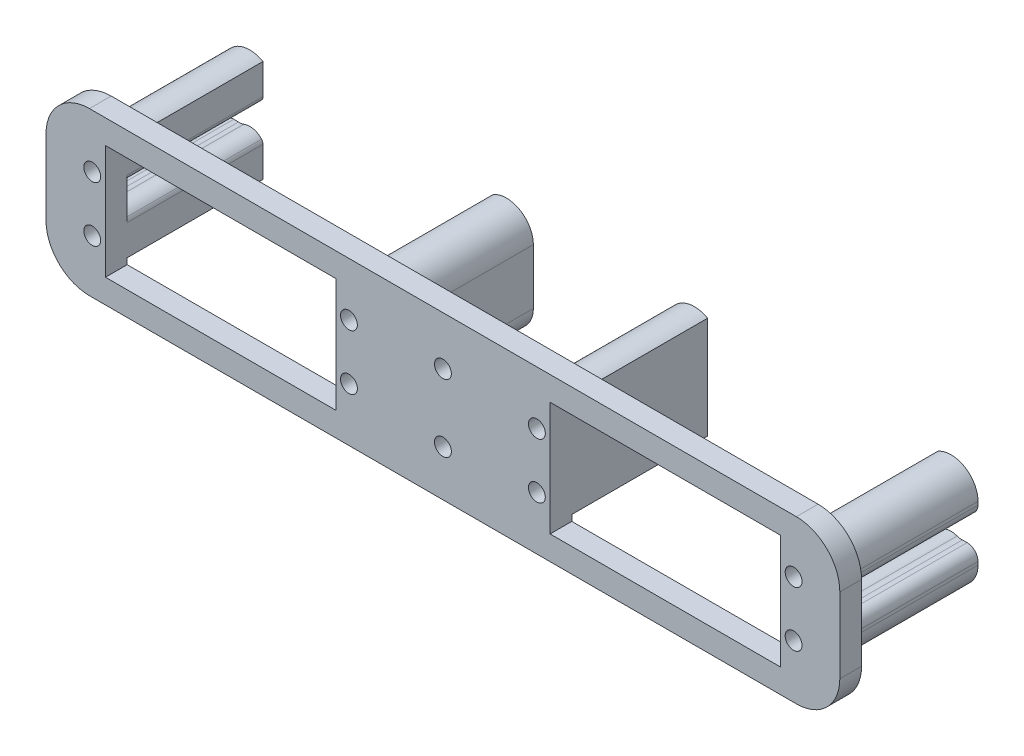
from build123d import *

# Parameters (mm, degrees)
SKETCH1_W                      = 146.142719433
SKETCH1_H                      = 29.841975708
BOSS_EXTRUDE1_DEPTH            = 4
SKETCH2_W                      = 42.4
SKETCH2_H                      = 21
CUT_EXTRUDE1_DEPTH             = 120.920808812
SKETCH3_W                      = 42.4
SKETCH3_H                      = 21
CUT_EXTRUDE2_DEPTH             = 120.920808812
BOSS_EXTRUDE2_DEPTH            = 25
BOSS_EXTRUDE3_DEPTH            = 25
BOSS_EXTRUDE4_DEPTH            = 25
BOSS_EXTRUDE5_DEPTH            = 25
BOSS_EXTRUDE6_DEPTH            = 25
BOSS_EXTRUDE7_DEPTH            = 25
F_3_1_3_1_DIAMETER_HOLE1_D     = 3.1
F_3_1_3_1_DIAMETER_HOLE1_DEPTH = 29
F_3_1_3_1_DIAMETER_HOLE2_D     = 3.1
FILLET1_R                      = 1
FILLET2_R                      = 2
FILLET3_R                      = 8


with BuildPart() as part:
    # Sketch1 → Boss-Extrude1 (new body)
    with BuildSketch(Plane.XY.offset(29.720987506)):
        with Locations((40.928641953, 22.079012221)):
            Rectangle(SKETCH1_W, SKETCH1_H)
    extrude(amount=-BOSS_EXTRUDE1_DEPTH)

    # Sketch2 → Cut-Extrude1 (cut, through all)
    with BuildSketch(Plane.XY.offset(29.720987506)):
        with Locations((0, 22.079011948)):
            Rectangle(SKETCH2_W, SKETCH2_H)
    extrude(amount=-CUT_EXTRUDE1_DEPTH, mode=Mode.SUBTRACT)

    # Sketch3 → Cut-Extrude2 (cut, through all)
    with BuildSketch(Plane(origin=(0, 0, 25.720987506), x_dir=(-1, 0, 0), z_dir=(0, 0, -1))):
        with Locations((-81.857283905, 22.079012494)):
            Rectangle(SKETCH3_W, SKETCH3_H)
    extrude(amount=-CUT_EXTRUDE2_DEPTH, mode=Mode.SUBTRACT)

    # Sketch4 → Boss-Extrude2 (add)
    with BuildSketch(Plane(origin=(0, 0, 25.720987506), x_dir=(-1, 0, 0), z_dir=(0, 0, -1))):
        with BuildLine():
            Line((28.579999925, 27.164011892), (28.579999925, 24.579012633))
            Line((28.579999925, 24.579012633), (25.700002555, 24.579012633))
            ThreePointArc((25.700002555, 24.579012633), (25.204684679, 24.573625897), (24.72588263, 24.446671519))
            ThreePointArc((24.72588263, 24.446671519), (22.771679916, 24.362550773), (21.2, 25.52694194))
            Line((21.2, 25.52694194), (21.2, 31.476505426))
            ThreePointArc((21.2, 31.476505426), (26.12739861, 31.437827499), (28.579999925, 27.164011892))
        make_face()
    extrude(amount=BOSS_EXTRUDE2_DEPTH)

    # Sketch5 → Boss-Extrude3 (add)
    with BuildSketch(Plane(origin=(0, 0, 25.720987506), x_dir=(-1, 0, 0), z_dir=(0, 0, -1))):
        with BuildLine():
            Line((25.700002576, 19.579012066), (28.580000075, 19.579012066))
            Line((28.580000075, 19.579012066), (28.580000075, 16.994011892))
            ThreePointArc((28.580000075, 16.994011892), (26.127398683, 12.720196248), (21.2, 12.68151847))
            Line((21.2, 12.68151847), (21.2, 18.631083048))
            ThreePointArc((21.2, 18.631083048), (22.771680162, 19.795473883), (24.725882875, 19.711353108))
            ThreePointArc((24.725882875, 19.711353108), (25.204684818, 19.58439879), (25.700002576, 19.579012066))
        make_face()
    extrude(amount=BOSS_EXTRUDE3_DEPTH)

    # Sketch6 → Boss-Extrude4 (add)
    with BuildSketch(Plane(origin=(0, 0, 25.720987506), x_dir=(-1, 0, 0), z_dir=(0, 0, -1))):
        with BuildLine():
            Line((-107.557286435, 24.579012773), (-110.437283905, 24.579012773))
            Line((-110.437283905, 24.579012773), (-110.437283905, 27.164012494))
            ThreePointArc((-110.437283905, 27.164012494), (-107.984682551, 31.43782812), (-103.057283905, 31.476505972))
            Line((-103.057283905, 31.476505972), (-103.057283905, 25.52694194))
            ThreePointArc((-103.057283905, 25.52694194), (-104.628963944, 24.362550939), (-106.583166657, 24.4466717))
            ThreePointArc((-106.583166657, 24.4466717), (-107.061968635, 24.573626043), (-107.557286435, 24.579012773))
        make_face()
    extrude(amount=BOSS_EXTRUDE4_DEPTH)

    # Sketch7 → Boss-Extrude5 (add)
    with BuildSketch(Plane(origin=(0, 0, 25.720987506), x_dir=(-1, 0, 0), z_dir=(0, 0, -1))):
        with BuildLine():
            Line((-110.437283905, 16.994012494), (-110.437283905, 19.579012206))
            Line((-110.437283905, 19.579012206), (-107.557286506, 19.579012206))
            ThreePointArc((-107.557286506, 19.579012206), (-107.06196867, 19.584398936), (-106.583166657, 19.711353289))
            ThreePointArc((-106.583166657, 19.711353289), (-104.628963944, 19.795474049), (-103.057283905, 18.631083048))
            Line((-103.057283905, 18.631083048), (-103.057283905, 12.681519016))
            ThreePointArc((-103.057283905, 12.681519016), (-107.984682551, 12.720196869), (-110.437283905, 16.994012494))
        make_face()
    extrude(amount=BOSS_EXTRUDE5_DEPTH)

    # Sketch8 → Boss-Extrude6 (add)
    with BuildSketch(Plane(origin=(0, 0, 25.720987506), x_dir=(-1, 0, 0), z_dir=(0, 0, -1))):
        with BuildLine():
            Line((-28.58, 16.994011948), (-28.58, 27.164011948))
            ThreePointArc((-28.58, 27.164011948), (-26.127398647, 31.437827573), (-21.2, 31.476505426))
            Line((-21.2, 31.476505426), (-21.2, 12.68151847))
            ThreePointArc((-21.2, 12.68151847), (-26.127398647, 12.720196322), (-28.58, 16.994011948))
        make_face()
    extrude(amount=BOSS_EXTRUDE6_DEPTH)

    # Sketch9 → Boss-Extrude7 (add)
    with BuildSketch(Plane(origin=(0, 0, 25.720987506), x_dir=(-1, 0, 0), z_dir=(0, 0, -1))):
        with BuildLine():
            Line((-53.277283905, 27.164012494), (-53.277283905, 16.994012494))
            ThreePointArc((-53.277283905, 16.994012494), (-55.729885258, 12.720196869), (-60.657283905, 12.681519016))
            Line((-60.657283905, 12.681519016), (-60.657283905, 31.476505972))
            ThreePointArc((-60.657283905, 31.476505972), (-55.729885258, 31.43782812), (-53.277283905, 27.164012494))
        make_face()
    extrude(amount=BOSS_EXTRUDE7_DEPTH)

    # Ø3.1 (3.1) Diameter Hole1
    with Locations(Plane.XY.offset(29.720987506)):
        with Locations((40.928641952, 15.618518294), (40.928641952, 28.039506364)):
            Hole(F_3_1_3_1_DIAMETER_HOLE1_D / 2, depth=F_3_1_3_1_DIAMETER_HOLE1_DEPTH)

    # Ø3.1 (3.1) Diameter Hole2 (through all)
    with Locations(Plane.XY.offset(29.720987506)):
        with Locations((-23.63, 27.164011948), (-23.63, 16.994011948), (23.63, 16.994011948), (23.63, 27.164011948), (58.227283905, 16.994012494), (58.227283905, 27.164012494), (105.487283905, 16.994012494), (105.487283905, 27.164012494)):
            Hole(F_3_1_3_1_DIAMETER_HOLE2_D / 2)

    # Fillet1
    fillet1_edges = [part.edges().sort_by_distance(p)[0] for p in [
        (103.057283905, 18.631083048, 13.220987506),
        (-21.2, 25.52694194, 13.220987506),
        (-21.2, 18.631083048, 13.220987506),
        (103.057283905, 25.52694194, 13.220987506),
    ]]
    fillet(fillet1_edges, radius=FILLET1_R)

    # Fillet2
    fillet2_edges = [part.edges().sort_by_distance(p)[0] for p in [
        (110.437283905, 19.579012206, 13.220987506),
        (-28.579999925, 24.579012633, 13.220987506),
        (-28.580000075, 19.579012066, 13.220987506),
        (110.437283905, 24.579012773, 13.220987506),
    ]]
    fillet(fillet2_edges, radius=FILLET2_R)

    # Fillet3
    fillet3_edges = [part.edges().sort_by_distance(p)[0] for p in [
        (-32.142717764, 7.158024367, 27.720987506),
        (-32.142717764, 37.000000075, 27.720987506),
        (114.000001669, 37.000000075, 27.720987506),
        (114.000001669, 7.158024367, 27.720987506),
    ]]
    fillet(fillet3_edges, radius=FILLET3_R)


solid = part.part
